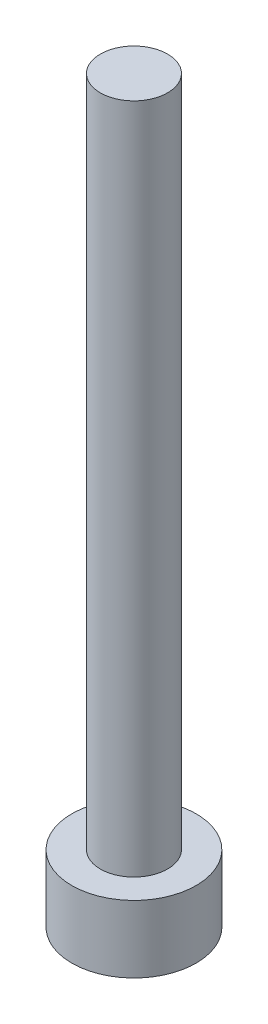
from build123d import *

# Parameters (mm, degrees)
SKETCH1_R           = 1.85
BOSS_EXTRUDE1_DEPTH = 2
SKETCH2_R           = 1
BOSS_EXTRUDE2_DEPTH = 20


with BuildPart() as part:
    # Sketch1 → Boss-Extrude1 (new body)
    with BuildSketch(Plane(origin=(0, 0, 0), x_dir=(1, 0, 0), z_dir=(0, 1, 0))):
        with Locations(Location((0, 0, 0), (0, 0, 270))):
            Circle(SKETCH1_R)
    extrude(amount=BOSS_EXTRUDE1_DEPTH)

    # Sketch2 → Boss-Extrude2 (add)
    with BuildSketch(Plane(origin=(0, 2, 0), x_dir=(1, 0, 0), z_dir=(0, 1, 0))):
        with Locations(Location((0, 0, 0), (0, 0, 270))):
            Circle(SKETCH2_R)
    extrude(amount=BOSS_EXTRUDE2_DEPTH)


solid = part.part
